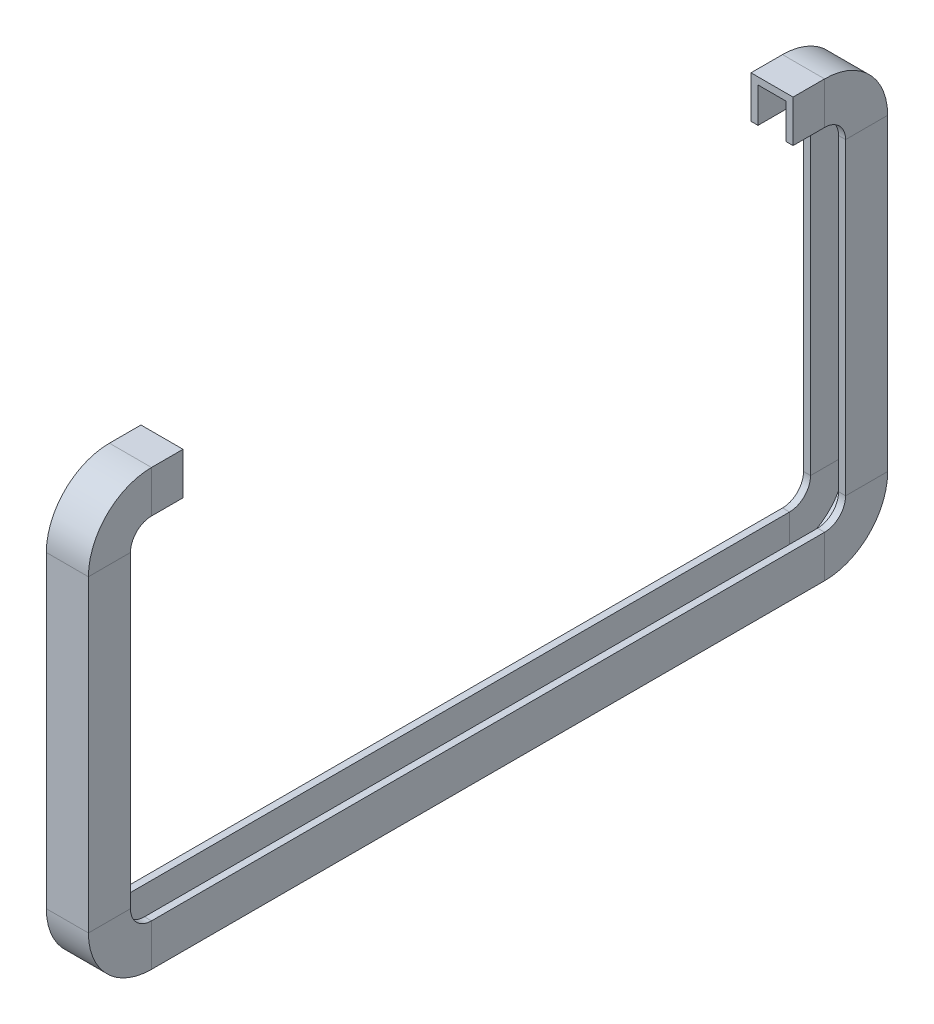
from build123d import *


with BuildPart() as part:
    # Sweep3: sweep along a path in Sketch3
    with BuildLine(Plane(origin=(0, 0, 0), x_dir=(0, 0, -1), z_dir=(1, 0, 0))) as sweep3_path:
        Line((0, 0), (-7.1374, 0))
        ThreePointArc((-7.1374, 0), (-16.117656121, -3.719743879), (-19.8374, -12.7))
        Line((-19.8374, -12.7), (-19.8374, -82.55))
        ThreePointArc((-19.8374, -82.55), (-16.117656121, -91.530256121), (-7.1374, -95.25))
        Line((-7.1374, -95.25), (145.2626, -95.25))
        ThreePointArc((145.2626, -95.25), (154.242856121, -91.530256121), (157.9626, -82.55))
        Line((157.9626, -82.55), (157.9626, -12.7))
        ThreePointArc((157.9626, -12.7), (154.242856121, -3.719743879), (145.2626, 0))
        Line((145.2626, 0), (138.1252, 0))
    # Sketch2 → Sweep3 (sweep)
    with BuildSketch(Plane.XY):
        Polygon((0, 0), (6.35, 0), (6.35, -7.9375), (7.9375, -7.9375), (7.9375, 1.5875), (-1.5875, 1.5875), (-1.5875, -7.9375), (0, -7.9375), align=None)
    sweep(path=sweep3_path.line)


solid = part.part
